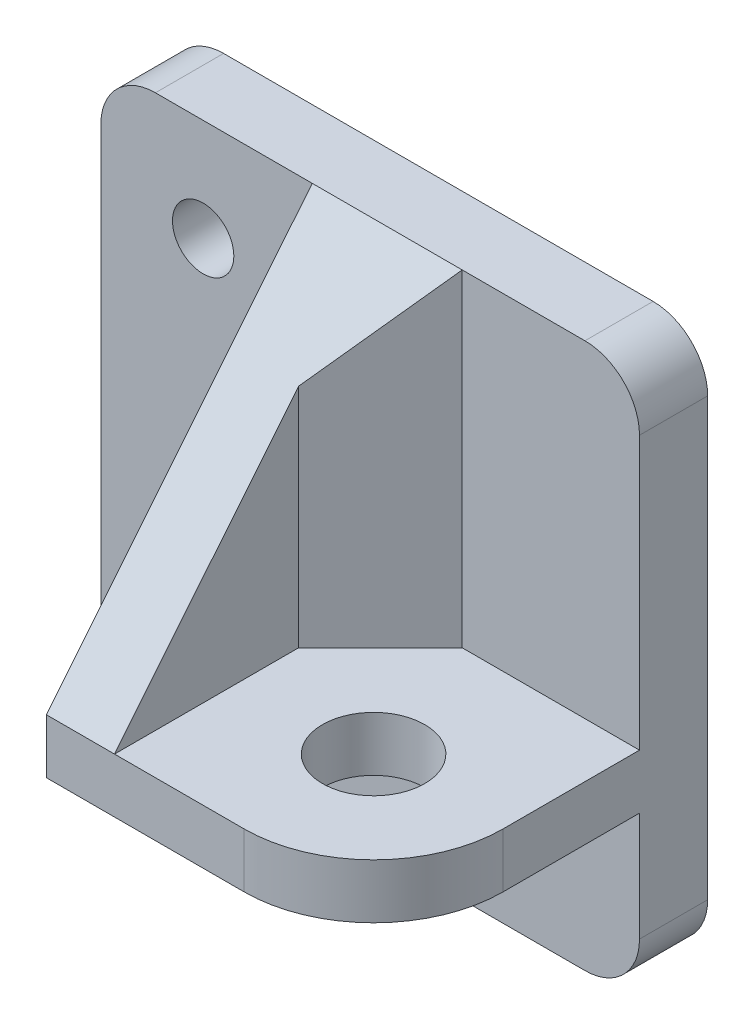
from build123d import *

# Parameters (mm, degrees)
SKETCH1_W           = 39.5
SKETCH1_H           = 40
SKETCH1_R           = 2.25
BOSS_EXTRUDE1_DEPTH = 5
BOSS_EXTRUDE2_START = -12
SKETCH2_R           = 3.75
BOSS_EXTRUDE2_DEPTH = 4
BOSS_EXTRUDE3_DEPTH = 5
FILLET1_R           = 4
CHAMFER2_SIZE       = 6


with BuildPart() as part:
    # Sketch1 → Boss-Extrude1 (new body)
    with BuildSketch(Plane.XY):
        with Locations((12.25, 0)):
            Rectangle(SKETCH1_W, SKETCH1_H)
        with Locations((0, 12.5)):
            Circle(SKETCH1_R, mode=Mode.SUBTRACT)
        with Locations((0, -12.5)):
            Circle(SKETCH1_R, mode=Mode.SUBTRACT)
    extrude(amount=BOSS_EXTRUDE1_DEPTH)

    # Sketch2 → Boss-Extrude2 (add)
    with BuildSketch(Plane.XZ.offset(20).offset(BOSS_EXTRUDE2_START)):
        with BuildLine():
            Line((32, 5), (13, 5))
            Line((13, 5), (13, 24.5))
            Line((13, 24.5), (22.5, 24.5))
            ThreePointArc((22.5, 24.5), (29.217514421, 21.717514421), (32, 15))
            Line((32, 15), (32, 5))
        make_face()
        with Locations(Location((22.5, 15, 0), (0, 0, 270))):
            Circle(SKETCH2_R, mode=Mode.SUBTRACT)
    extrude(amount=-BOSS_EXTRUDE2_DEPTH)

    # Sketch3 → Boss-Extrude3 (add)
    with BuildSketch(Plane.ZY.offset(-13)):
        Polygon((24.5, -4), (5, 20), (5, -4), (5, -8), (24.5, -8), align=None)
    extrude(amount=BOSS_EXTRUDE3_DEPTH)

    # Fillet1
    fillet1_edges = [part.edges().sort_by_distance(p)[0] for p in [
        (32, 20, 2.5),
        (-7.5, -20, 2.5),
        (-7.5, 20, 2.5),
        (32, -20, 2.5),
    ]]
    fillet(fillet1_edges, radius=FILLET1_R)

    # Chamfer2
    chamfer2_edges = [part.edges().sort_by_distance(p)[0] for p in [
        (13, 8, 5),
    ]]
    chamfer(chamfer2_edges, length=CHAMFER2_SIZE)


solid = part.part
